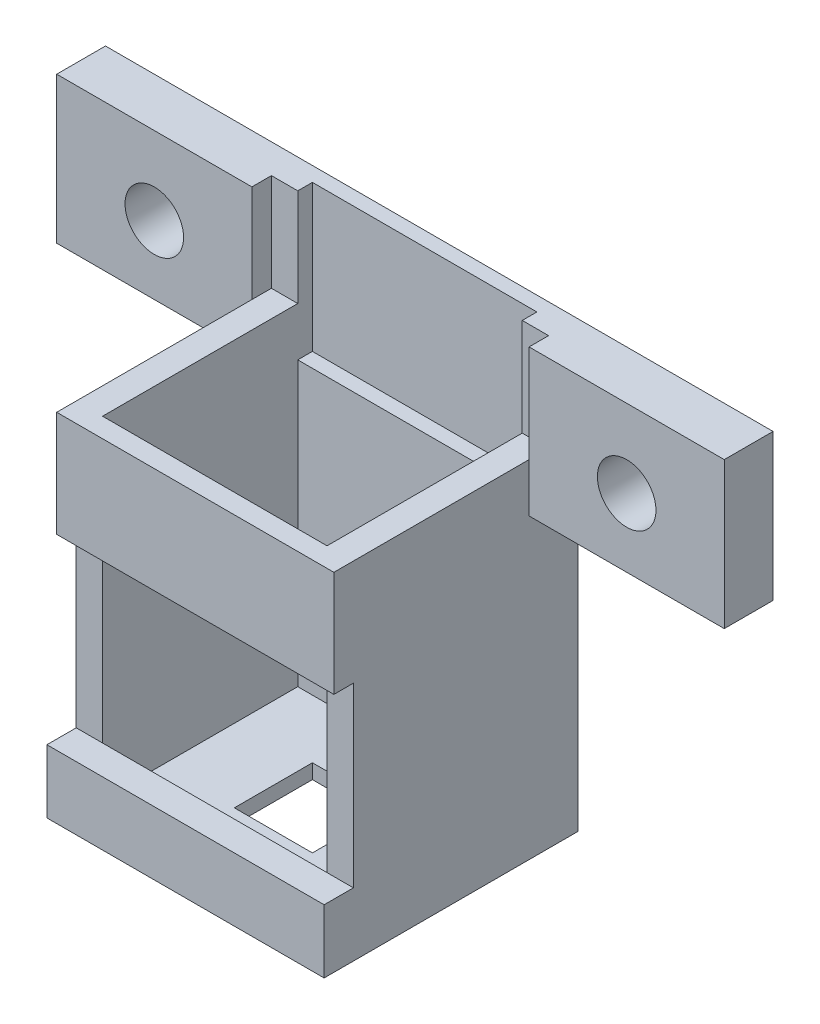
from build123d import *

# Parameters (mm, degrees)
SKETCH1_W           = 23
SKETCH1_H           = 20
BOSS_EXTRUDE1_DEPTH = 3
SKETCH2_W           = 20
SKETCH2_H           = 37
BOSS_EXTRUDE2_DEPTH = 2.7
SKETCH3_W           = 20
SKETCH3_H           = 37
BOSS_EXTRUDE3_DEPTH = 2.7
SKETCH4_W           = 28.4
SKETCH4_H           = 8
BOSS_EXTRUDE4_DEPTH = 3
SKETCH5_W           = 28.4
SKETCH5_H           = 47
BOSS_EXTRUDE5_DEPTH = 3
SKETCH6_W           = 5
SKETCH6_H           = 15
BOSS_EXTRUDE6_DEPTH = 20
SKETCH7_W           = 5
SKETCH7_H           = 15
BOSS_EXTRUDE7_DEPTH = 20
SKETCH8_W           = 8
SKETCH8_H           = 8
CUT_EXTRUDE1_DEPTH  = 15
SKETCH9_R           = 3
CUT_EXTRUDE2_DEPTH  = 15
SKETCH10_W          = 28.45
SKETCH10_H          = 26
CUT_EXTRUDE3_DEPTH  = 1.5
SKETCH12_W          = 23
SKETCH12_H          = 1.5
CUT_EXTRUDE4_DEPTH  = 15
SKETCH13_W          = 28.4
SKETCH13_H          = 10.836340194
BOSS_EXTRUDE8_DEPTH = 2


with BuildPart() as part:
    # Sketch1 → Boss-Extrude1 (new body)
    with BuildSketch(Plane(origin=(0, 0, 0), x_dir=(1, 0, 0), z_dir=(0, 1, 0))):
        with Locations((11.5, 10)):
            Rectangle(SKETCH1_W, SKETCH1_H)
    extrude(amount=BOSS_EXTRUDE1_DEPTH)

    # Sketch2 → Boss-Extrude2 (add)
    with BuildSketch(Plane.ZY):
        with Locations((-10, 18.5)):
            Rectangle(SKETCH2_W, SKETCH2_H)
    extrude(amount=BOSS_EXTRUDE2_DEPTH)

    # Sketch3 → Boss-Extrude3 (add)
    with BuildSketch(Plane(origin=(23, 0, 0), x_dir=(0, 0, -1), z_dir=(1, 0, 0))):
        with Locations((10, 18.5)):
            Rectangle(SKETCH3_W, SKETCH3_H)
    extrude(amount=BOSS_EXTRUDE3_DEPTH)

    # Sketch4 → Boss-Extrude4 (add)
    with BuildSketch(Plane.XY):
        with Locations((11.5, 4)):
            Rectangle(SKETCH4_W, SKETCH4_H)
    extrude(amount=BOSS_EXTRUDE4_DEPTH)

    # Sketch5 → Boss-Extrude5 (add)
    with BuildSketch(Plane(origin=(0, 0, -20), x_dir=(-1, 0, 0), z_dir=(0, 0, -1))):
        with Locations((-11.5, 23.5)):
            Rectangle(SKETCH5_W, SKETCH5_H)
    extrude(amount=BOSS_EXTRUDE5_DEPTH)

    # Sketch6 → Boss-Extrude6 (add)
    with BuildSketch(Plane(origin=(25.7, 0, 0), x_dir=(0, 0, -1), z_dir=(1, 0, 0))):
        with Locations((20.5, 39.5)):
            Rectangle(SKETCH6_W, SKETCH6_H)
    extrude(amount=BOSS_EXTRUDE6_DEPTH)

    # Sketch7 → Boss-Extrude7 (add)
    with BuildSketch(Plane.ZY.offset(2.7)):
        with Locations((-20.5, 39.5)):
            Rectangle(SKETCH7_W, SKETCH7_H)
    extrude(amount=BOSS_EXTRUDE7_DEPTH)

    # Sketch8 → Cut-Extrude1 (cut)
    with BuildSketch(Plane(origin=(0, 3, 0), x_dir=(1, 0, 0), z_dir=(0, 1, 0))):
        with Locations((11.5, 10)):
            Rectangle(SKETCH8_W, SKETCH8_H)
    extrude(amount=-CUT_EXTRUDE1_DEPTH, mode=Mode.SUBTRACT)

    # Sketch9 → Cut-Extrude2 (cut)
    with BuildSketch(Plane.XY.offset(-18)):
        with Locations((-12.7, 39)):
            Circle(SKETCH9_R)
        with Locations((35.7, 39)):
            Circle(SKETCH9_R)
    extrude(amount=-CUT_EXTRUDE2_DEPTH, mode=Mode.SUBTRACT)

    # Sketch10 → Cut-Extrude3 (cut)
    with BuildSketch(Plane.XZ):
        with Locations((11.525, -10)):
            Rectangle(SKETCH10_W, SKETCH10_H)
    extrude(amount=-CUT_EXTRUDE3_DEPTH, mode=Mode.SUBTRACT)

    # Sketch12 → Cut-Extrude4 (cut)
    with BuildSketch(Plane(origin=(0, 47, 0), x_dir=(1, 0, 0), z_dir=(0, 1, 0))):
        with Locations((11.5, 20.75)):
            Rectangle(SKETCH12_W, SKETCH12_H)
    extrude(amount=-CUT_EXTRUDE4_DEPTH, mode=Mode.SUBTRACT)

    # Sketch13 → Boss-Extrude8 (add)
    with BuildSketch(Plane.XY):
        with Locations((11.5, 31.581829903)):
            Rectangle(SKETCH13_W, SKETCH13_H)
    extrude(amount=BOSS_EXTRUDE8_DEPTH)


solid = part.part
